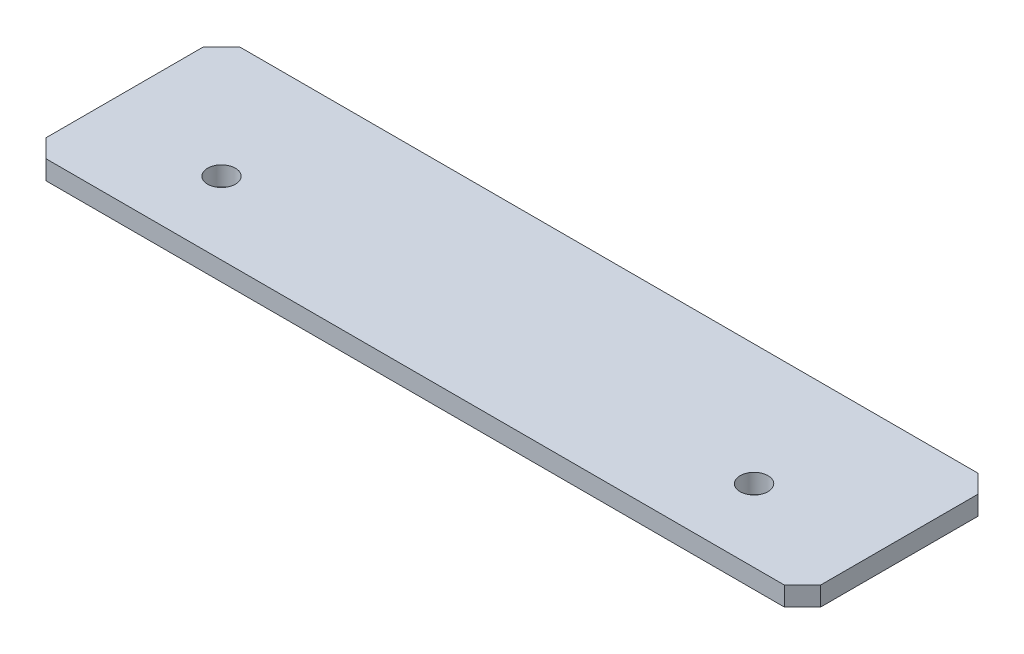
from build123d import *

# Parameters (mm, degrees)
SKETCH1_R           = 11.5
BOSS_EXTRUDE1_DEPTH = 7.9


with BuildPart() as part:
    # Sketch1 → Boss-Extrude1 (new, symmetric)
    with BuildSketch(Plane(origin=(0, 0, 0), x_dir=(1, 0, 0), z_dir=(0, 1, 0))):
        Polygon((-320, 65), (-305, 80), (305, 80), (320, 65), (320, -65), (305, -80), (-305, -80), (-320, -65), align=None)
        with Locations(Location((-220, -20, 0), (0, 0, 270))):
            Circle(SKETCH1_R, mode=Mode.SUBTRACT)
        with Locations(Location((220, -20, 0), (0, 0, 270))):
            Circle(SKETCH1_R, mode=Mode.SUBTRACT)
    extrude(amount=BOSS_EXTRUDE1_DEPTH, both=True)


solid = part.part
